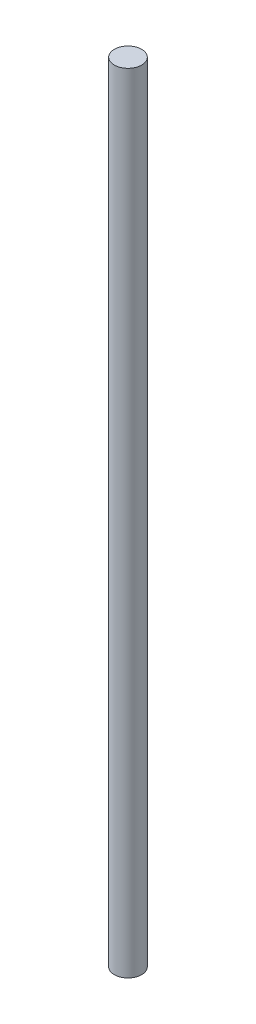
from build123d import *

# Parameters (mm, degrees)
SKETCH1_R             = 15.875
SHAFT_EXTRUSION_DEPTH = 914.4


with BuildPart() as part:
    # Sketch1 → Shaft extrusion (new body)
    with BuildSketch(Plane(origin=(0, 0, 0), x_dir=(1, 0, 0), z_dir=(0, 1, 0))):
        with Locations(Location((0, 0, 0), (0, 0, 270))):
            Circle(SKETCH1_R)
    extrude(amount=SHAFT_EXTRUSION_DEPTH)


solid = part.part
